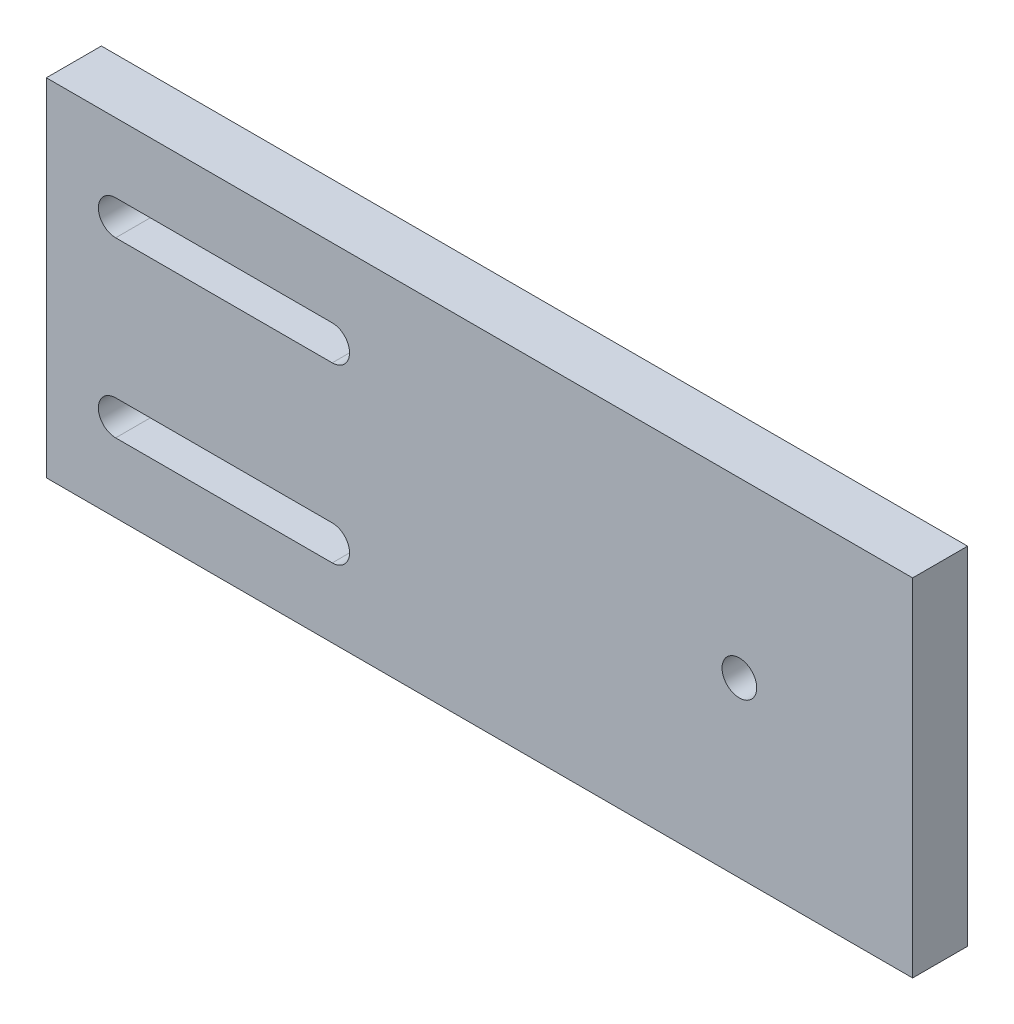
from build123d import *

# Parameters (mm, degrees)
SKETCH1_W           = 100
SKETCH1_H           = 40
SKETCH1_R           = 2
BOSS_EXTRUDE1_DEPTH = 6.35


with BuildPart() as part:
    # Sketch1 → Boss-Extrude1 (new body)
    with BuildSketch(Plane.XY):
        with Locations((50, 20)):
            Rectangle(SKETCH1_W, SKETCH1_H)
        with Locations((80, 20)):
            Circle(SKETCH1_R, mode=Mode.SUBTRACT)
        with BuildLine():
            Line((8, 32), (33, 32))
            ThreePointArc((33, 32), (35, 30), (33, 28))
            Line((33, 28), (8, 28))
            ThreePointArc((8, 28), (6, 30), (8, 32))
        make_face(mode=Mode.SUBTRACT)
        with BuildLine():
            Line((8, 12), (33, 12))
            ThreePointArc((33, 12), (35, 10), (33, 8))
            Line((33, 8), (8, 8))
            ThreePointArc((8, 8), (6, 10), (8, 12))
        make_face(mode=Mode.SUBTRACT)
    extrude(amount=BOSS_EXTRUDE1_DEPTH)


solid = part.part
